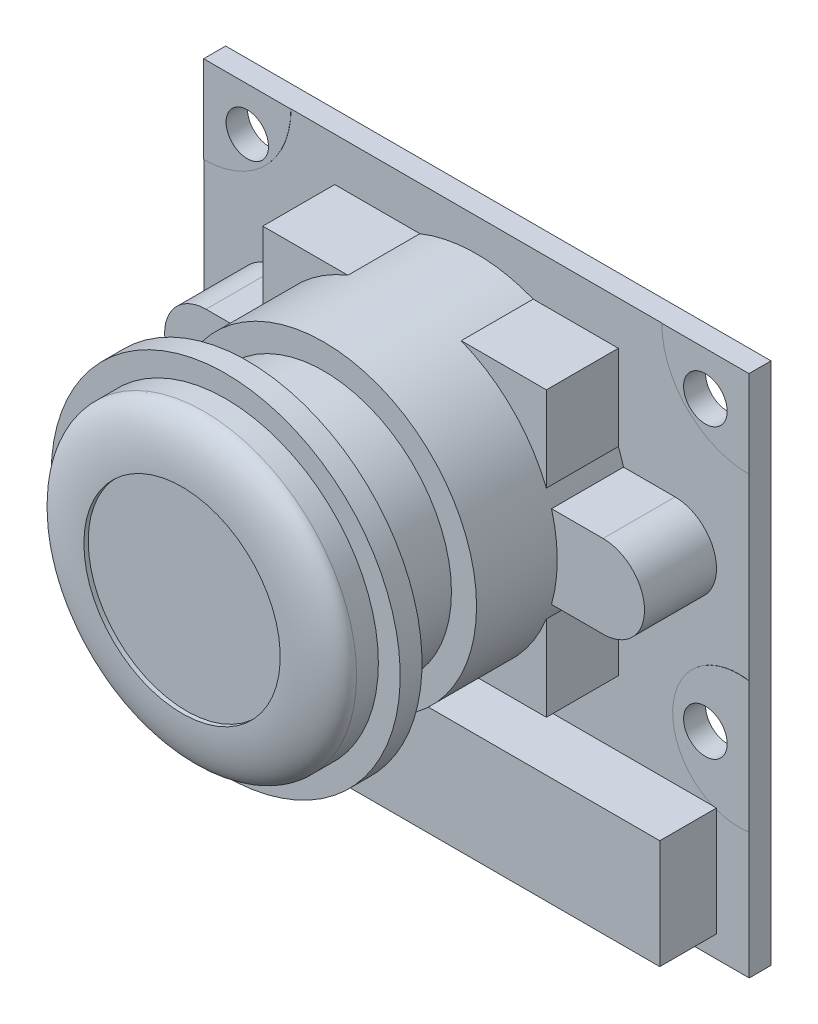
from build123d import *

# Parameters (mm, degrees)
CROQUIS1_W              = 25
CROQUIS1_H              = 24
SALIENTE_EXTRUIR1_DEPTH = 1
CROQUIS2_W              = 22
CROQUIS2_H              = 5
SALIENTE_EXTRUIR2_DEPTH = 2.6
SALIENTE_EXTRUIR3_DEPTH = 3.3
CROQUIS5_R              = 7
SALIENTE_EXTRUIR4_DEPTH = 7
CROQUIS6_R              = 5.85
SALIENTE_EXTRUIR5_DEPTH = 3.5
CROQUIS9_R              = 1
CORTAR_EXTRUIR1_DEPTH   = 1
SALIENTE_EXTRUIR6_START = 0.01
CROQUIS10_R             = 0.972515087
CROQUIS10_R_2           = 1
SALIENTE_EXTRUIR6_DEPTH = 0.01


with BuildPart() as part:
    # Croquis1 → Saliente-Extruir1 (new body)
    with BuildSketch(Plane.XY):
        Rectangle(CROQUIS1_W, CROQUIS1_H)
    extrude(amount=SALIENTE_EXTRUIR1_DEPTH)

    # Croquis2 → Saliente-Extruir2 (add)
    with BuildSketch(Plane.XY.offset(1)):
        with Locations((0, -8.5)):
            Rectangle(CROQUIS2_W, CROQUIS2_H)
    extrude(amount=SALIENTE_EXTRUIR2_DEPTH)

    # Croquis3 → Saliente-Extruir3 (add)
    with BuildSketch(Plane.XY.offset(1)):
        with BuildLine():
            Line((-9.1, 5.4), (-6.5, 5.4))
            Line((-6.5, 5.4), (-6.5, 10))
            Line((-6.5, 10), (6.5, 10))
            Line((6.5, 10), (6.5, 5.4))
            Line((6.5, 5.4), (9.1, 5.4))
            ThreePointArc((9.1, 5.4), (11, 3.5), (9.1, 1.6))
            Line((9.1, 1.6), (6.5, 1.6))
            Line((6.5, 1.6), (6.5, -3))
            Line((6.5, -3), (-6.5, -3))
            Line((-6.5, -3), (-6.5, 1.6))
            Line((-6.5, 1.6), (-9.1, 1.6))
            ThreePointArc((-9.1, 1.6), (-11, 3.5), (-9.1, 5.4))
        make_face()
    extrude(amount=SALIENTE_EXTRUIR3_DEPTH)

    # Croquis5 → Saliente-Extruir4 (add)
    with BuildSketch(Plane.XY.offset(1)):
        with Locations(Location((0, 3.5, 0), (0, 0, 164.250707132))):
            Circle(CROQUIS5_R)
    extrude(amount=SALIENTE_EXTRUIR4_DEPTH)

    # Croquis6 → Saliente-Extruir5 (add)
    with BuildSketch(Plane.XY.offset(8)):
        with Locations((0, 3.5)):
            Circle(CROQUIS6_R)
    extrude(amount=SALIENTE_EXTRUIR5_DEPTH)

    # Croquis8 → Revolución1 (revolve)
    with BuildSketch(Plane(origin=(0, 3.5, 0), x_dir=(-1, 0, 0), z_dir=(0, -1, 0)), mode=Mode.PRIVATE) as revoluci_n1_sk:
        with BuildLine():
            Line((0, -11.5), (-8, -11.5))
            Line((-8, -11.5), (-8, -12.5))
            Line((-8, -12.5), (-7, -12.5))
            Line((-7, -12.5), (-7, -13.5))
            add(Edge.make_bspline(
                [(-7, -13.5), (-7, -14.5), (-4.5, -14.5)],
                knots=[0, 0, 0, 1.570796327, 1.570796327, 1.570796327], degree=2, weights=[1, 0.707106781, 1]))
            Line((-4.5, -14.5), (-4.5, -14.3))
            Line((-4.5, -14.3), (0, -14.3))
            Line((0, -14.3), (0, -11.5))
        make_face()
    revolve(revoluci_n1_sk.sketch.rotate(Axis((0, 3.5, 11.5), (0, 0, 1)), 180), axis=Axis((0, 3.5, 11.5), (0, 0, 1)))

    # Croquis9 → Cortar-Extruir1 (cut)
    with BuildSketch(Plane.XY.offset(1)):
        with Locations((-10.5, 10)):
            Circle(CROQUIS9_R)
        with Locations((-10.5, -3.2)):
            Circle(CROQUIS9_R)
        with Locations((10.5, -3.2)):
            Circle(CROQUIS9_R)
        with Locations((10.5, 10)):
            Circle(CROQUIS9_R)
    extrude(amount=-CORTAR_EXTRUIR1_DEPTH, mode=Mode.SUBTRACT)

    # Croquis10 → Saliente-Extruir6 (add)
    # profile 1 of 4: a face of its own
    with BuildSketch(Plane.XY.offset(1).offset(SALIENTE_EXTRUIR6_START)):
        with BuildLine():
            Line((-12.5, 8), (-12.5, 12))
            Line((-12.5, 12), (-8.5, 12))
            ThreePointArc((-8.5, 12), (-9.671572875, 9.171572875), (-12.5, 8))
        make_face()
        with Locations(Location((-10.5, 10, 0), (0, 0, 180))):
            Circle(CROQUIS10_R, mode=Mode.SUBTRACT)
    # profile 2 of 4: a face of its own
    with BuildSketch(Plane.XY.offset(1).offset(SALIENTE_EXTRUIR6_START)):
        with BuildLine():
            Line((-12.5, -0.2), (-12.5, -6.2))
            ThreePointArc((-12.5, -6.2), (-9, -3.2), (-12.5, -0.2))
        make_face()
        with Locations((-10.5, -3.2)):
            Circle(CROQUIS10_R_2, mode=Mode.SUBTRACT)
    # profile 3 of 4: a face of its own
    with BuildSketch(Plane.XY.offset(1).offset(SALIENTE_EXTRUIR6_START)):
        with BuildLine():
            Line((8.5, 12), (12.5, 12))
            Line((12.5, 12), (12.5, 8))
            ThreePointArc((12.5, 8), (9.671572875, 9.171572875), (8.5, 12))
        make_face()
        with Locations((10.5, 10)):
            Circle(CROQUIS10_R_2, mode=Mode.SUBTRACT)
    # profile 4 of 4: a face of its own
    with BuildSketch(Plane.XY.offset(1).offset(SALIENTE_EXTRUIR6_START)):
        with BuildLine():
            Line((12.5, -6.2), (12.5, -0.2))
            ThreePointArc((12.5, -0.2), (9, -3.2), (12.5, -6.2))
        make_face()
        with Locations((10.5, -3.2)):
            Circle(CROQUIS10_R_2, mode=Mode.SUBTRACT)
    extrude(amount=-SALIENTE_EXTRUIR6_DEPTH)


solid = part.part
